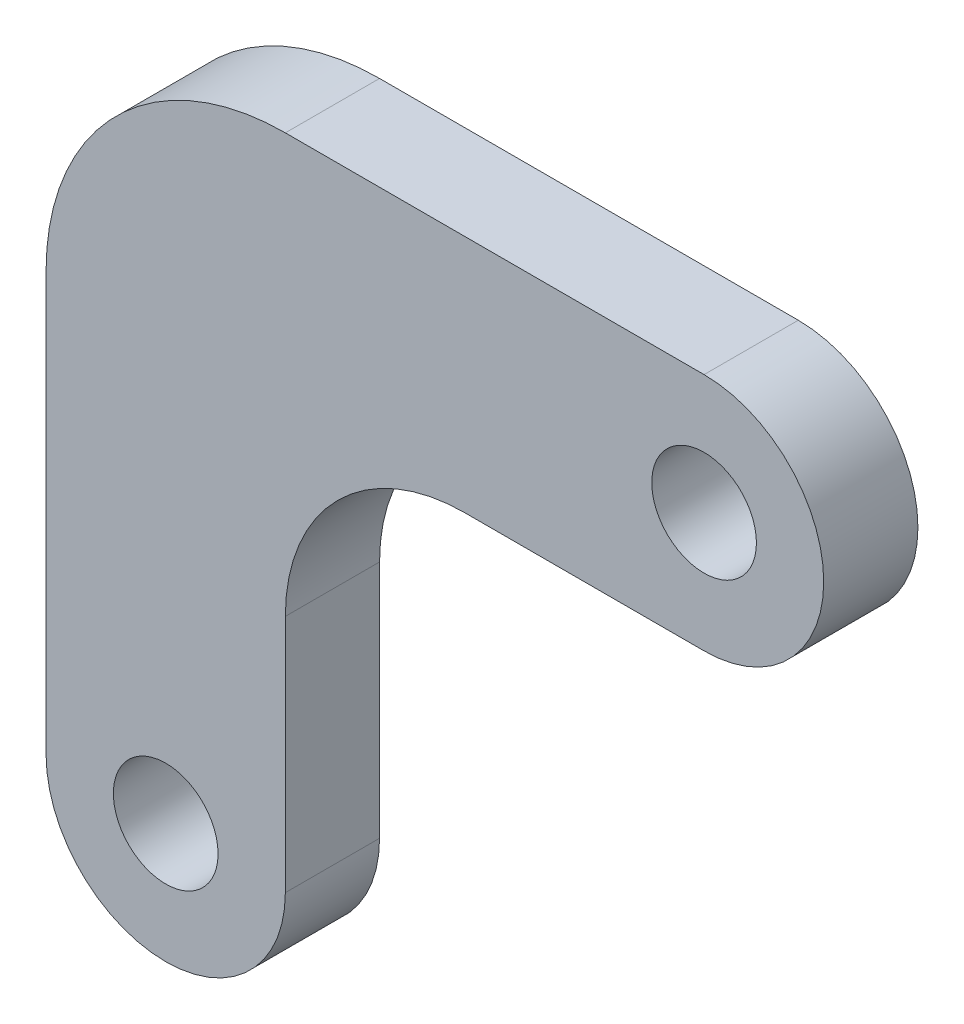
from build123d import *

# Parameters (mm, degrees)
SKETCH1_R           = 5.55625
BOSS_EXTRUDE1_DEPTH = 10


with BuildPart() as part:
    # Sketch1 → Boss-Extrude1 (new body)
    with BuildSketch(Plane.XY):
        with BuildLine():
            ThreePointArc((-12.7, 44.45), (-5.260512242, 62.410512242), (12.7, 69.85))
            Line((12.7, 69.85), (57.15, 69.85))
            ThreePointArc((57.15, 69.85), (69.85, 57.15), (57.15, 44.45))
            Line((57.15, 44.45), (31.75, 44.45))
            ThreePointArc((31.75, 44.45), (18.279615818, 38.870384182), (12.7, 25.4))
            Line((12.7, 25.4), (12.7, 0))
            ThreePointArc((12.7, 0), (0, -12.7), (-12.7, 0))
            Line((-12.7, 0), (-12.7, 44.45))
        make_face()
        with Locations((57.15, 57.15)):
            Circle(SKETCH1_R, mode=Mode.SUBTRACT)
        Circle(SKETCH1_R, mode=Mode.SUBTRACT)
    extrude(amount=BOSS_EXTRUDE1_DEPTH)


solid = part.part
